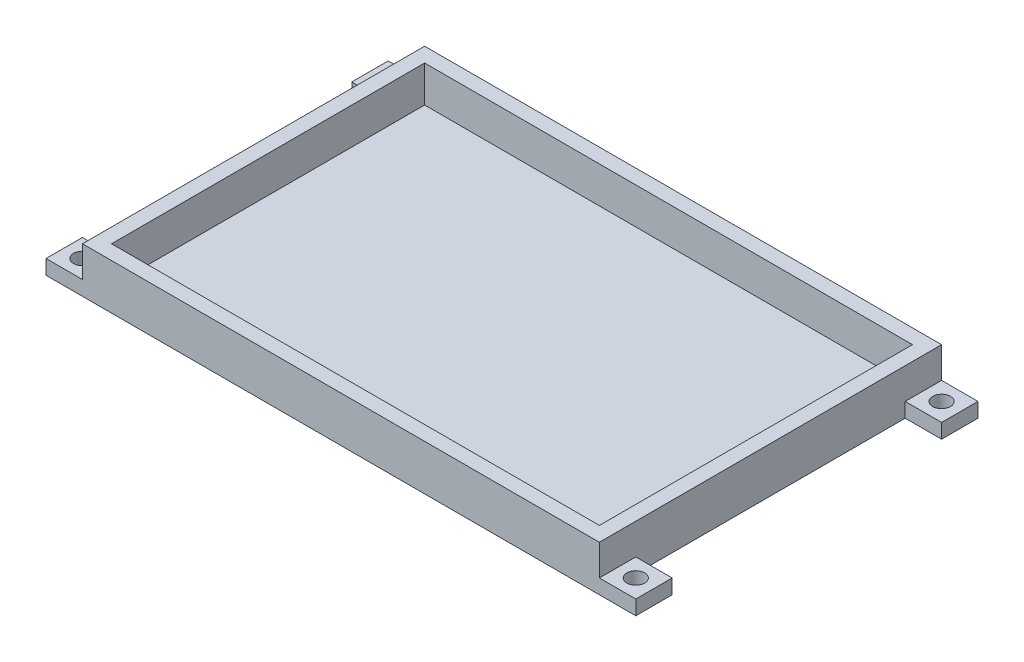
from build123d import *

# Parameters (mm, degrees)
SKETCH1_W           = 90.17
SKETCH1_H           = 59.69
SKETCH1_W_2         = 85.09
SKETCH1_H_2         = 54.61
BOSS_EXTRUDE1_DEPTH = 6.35
SKETCH2_W           = 90.17
SKETCH2_H           = 59.69
BOSS_EXTRUDE2_DEPTH = 1.5875
SKETCH3_W           = 6.35
SKETCH3_H           = 6.35
SKETCH3_R           = 1.55
BOSS_EXTRUDE3_DEPTH = 2.54


with BuildPart() as part:
    # Sketch1 → Boss-Extrude1 (new body)
    with BuildSketch(Plane(origin=(0, 0, 0), x_dir=(1, 0, 0), z_dir=(0, 1, 0))):
        with Locations((42.545, 27.305)):
            Rectangle(SKETCH1_W, SKETCH1_H)
        with Locations((42.545, 27.305)):
            Rectangle(SKETCH1_W_2, SKETCH1_H_2, mode=Mode.SUBTRACT)
    extrude(amount=BOSS_EXTRUDE1_DEPTH)

    # Sketch2 → Boss-Extrude2 (add)
    with BuildSketch(Plane.XZ):
        with Locations((42.545, -27.305)):
            Rectangle(SKETCH2_W, SKETCH2_H)
    extrude(amount=BOSS_EXTRUDE2_DEPTH)

    # Sketch3 → Boss-Extrude3 (add)
    # profile 1 of 4: a face of its own
    with BuildSketch(Plane.XZ.offset(1.5875)):
        with Locations((90.805, -0.635)):
            Rectangle(SKETCH3_W, SKETCH3_H)
        with Locations(Location((90.805, -0.635, 0), (0, 0, 270))):
            Circle(SKETCH3_R, mode=Mode.SUBTRACT)
    # profile 2 of 4: a face of its own
    with BuildSketch(Plane.XZ.offset(1.5875)):
        with Locations((-5.715, -0.635)):
            Rectangle(SKETCH3_W, SKETCH3_H)
        with Locations(Location((-5.715, -0.635, 0), (0, 0, 270))):
            Circle(SKETCH3_R, mode=Mode.SUBTRACT)
    # profile 3 of 4: a face of its own
    with BuildSketch(Plane.XZ.offset(1.5875)):
        with Locations((-5.715, -53.975)):
            Rectangle(SKETCH3_W, SKETCH3_H)
        with Locations(Location((-5.715, -53.975, 0), (0, 0, 270))):
            Circle(SKETCH3_R, mode=Mode.SUBTRACT)
    # profile 4 of 4: a face of its own
    with BuildSketch(Plane.XZ.offset(1.5875)):
        with Locations((90.805, -53.975)):
            Rectangle(SKETCH3_W, SKETCH3_H)
        with Locations(Location((90.805, -53.975, 0), (0, 0, 270))):
            Circle(SKETCH3_R, mode=Mode.SUBTRACT)
    extrude(amount=-BOSS_EXTRUDE3_DEPTH)


solid = part.part
